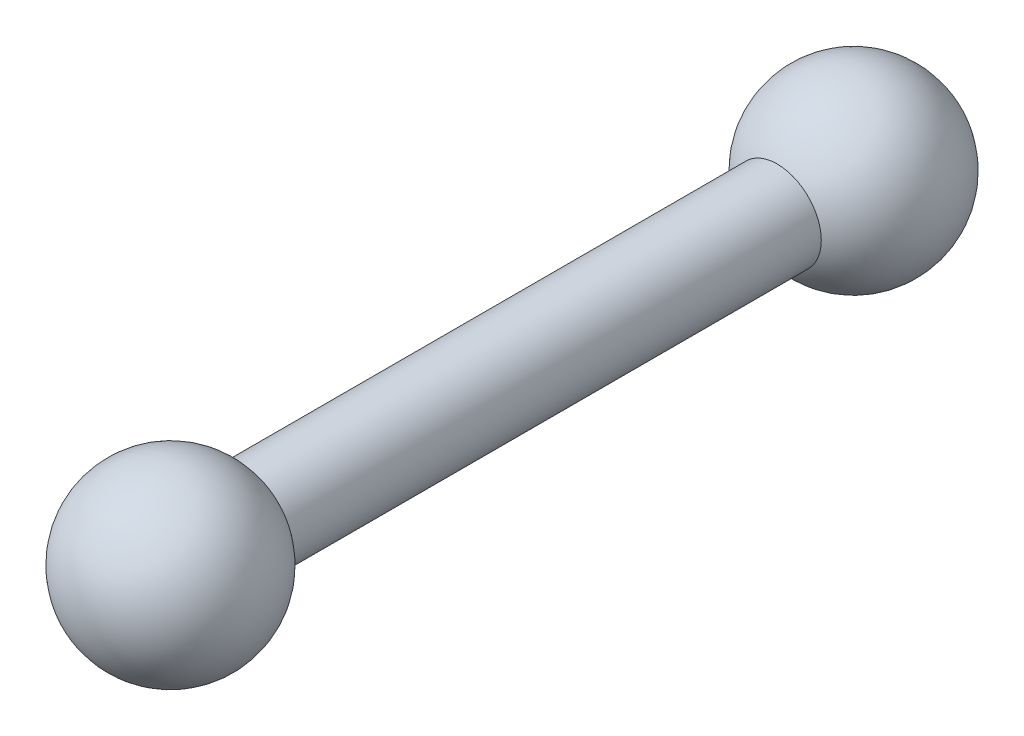
from build123d import *

# Parameters (mm, degrees)
SKETCH1_R           = 2
BOSS_EXTRUDE1_DEPTH = 25


with BuildPart() as part:
    # Sketch1 → Boss-Extrude1 (new body)
    with BuildSketch(Plane.XY):
        Circle(SKETCH1_R)
    extrude(amount=-BOSS_EXTRUDE1_DEPTH)

    # Sketch2 → Revolve1 (revolve)
    with BuildSketch(Plane.XY.offset(3)):
        with BuildLine():
            Line((0, 4), (0, -4))
            ThreePointArc((0, -4), (4, 0), (0, 4))
        make_face()
    revolve1 = revolve(axis=Axis((0, 4, 3), (0, -1, 0)))

    # Mirror1: Revolve1 across plane
    add(revolve1.mirror(Plane.XY.offset(-12.5)))


solid = part.part
